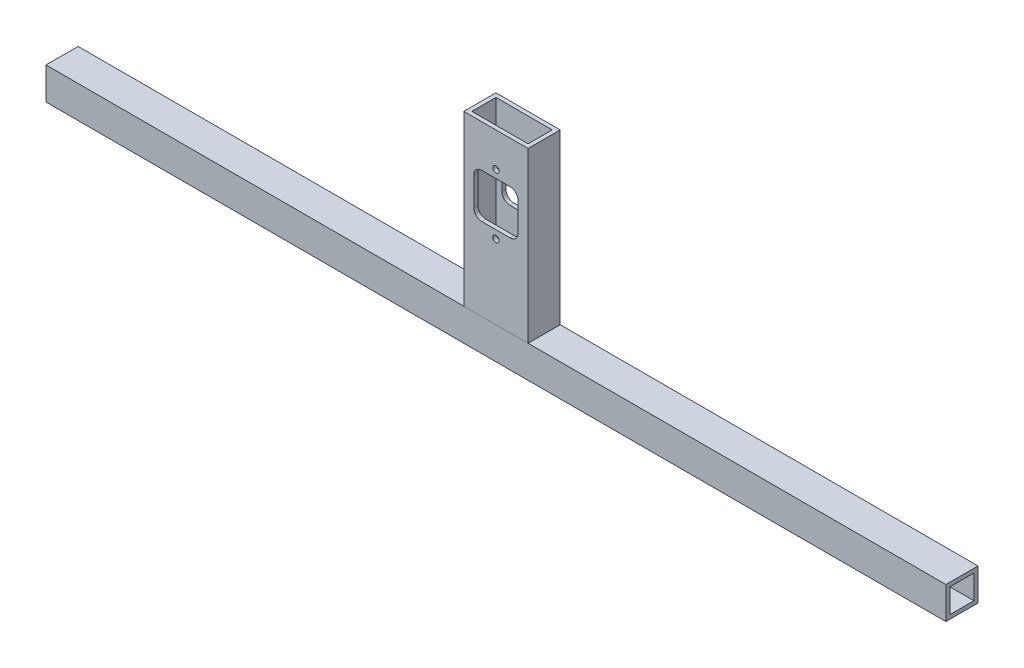
from build123d import *

# Parameters (mm, degrees)
CROQUIS5_W              = 711.2
CROQUIS5_H              = 25.4
SALIENTE_EXTRUIR1_DEPTH = 25.4
CROQUIS6_W              = 50.8
CROQUIS6_H              = 133.35
SALIENTE_EXTRUIR2_DEPTH = 25.4
VACIADO1_T              = -3.175
VACIADO2_T              = -3.175
CROQUIS7_R              = 2.4892
CORTAR_EXTRUIR1_DEPTH   = 423.545547467


with BuildPart() as part:
    # Croquis5 → Saliente-Extruir1 (new body)
    with BuildSketch(Plane.XY):
        with Locations((0, 80.772)):
            Rectangle(CROQUIS5_W, CROQUIS5_H)
    extrude(amount=-SALIENTE_EXTRUIR1_DEPTH)

    # Vaciado2
    vaciado2_openings = [part.faces().sort_by_distance(p)[0] for p in [
        (355.6, 80.772, -12.7),
        (-355.6, 80.772, -12.7),
    ]]
    offset(amount=VACIADO2_T, openings=vaciado2_openings, kind=Kind.INTERSECTION)


with BuildPart() as body_2:
    # Croquis6 → Saliente-Extruir2 (new body)
    with BuildSketch(Plane.XY):
        with Locations((0, 160.147)):
            Rectangle(CROQUIS6_W, CROQUIS6_H)
    extrude(amount=-SALIENTE_EXTRUIR2_DEPTH)

    # Vaciado1
    vaciado1_openings = [body_2.faces().sort_by_distance(p)[0] for p in [
        (0, 226.822, -12.7),
        (0, 93.472, -12.7),
    ]]
    offset(amount=VACIADO1_T, openings=vaciado1_openings, kind=Kind.INTERSECTION)

    # Croquis7 → Cortar-Extruir1 (cut, through all)
    with BuildSketch(Plane.XY):
        with Locations((0, 199.8345)):
            Circle(CROQUIS7_R)
        with Locations((0, 152.2095)):
            Circle(CROQUIS7_R)
        with BuildLine():
            Line((-11.1506, 158.5214), (11.1506, 158.5214))
            ThreePointArc((11.1506, 158.5214), (15.640728061, 160.381271939), (17.5006, 164.8714))
            Line((17.5006, 164.8714), (17.5006, 187.1726))
            ThreePointArc((17.5006, 187.1726), (15.640728061, 191.662728061), (11.1506, 193.5226))
            Line((11.1506, 193.5226), (-11.1506, 193.5226))
            ThreePointArc((-11.1506, 193.5226), (-15.640728061, 191.662728061), (-17.5006, 187.1726))
            Line((-17.5006, 187.1726), (-17.5006, 164.8714))
            ThreePointArc((-17.5006, 164.8714), (-15.640728061, 160.381271939), (-11.1506, 158.5214))
        make_face()
    extrude(amount=-CORTAR_EXTRUIR1_DEPTH, mode=Mode.SUBTRACT)


solid = Compound([part.part, body_2.part])
